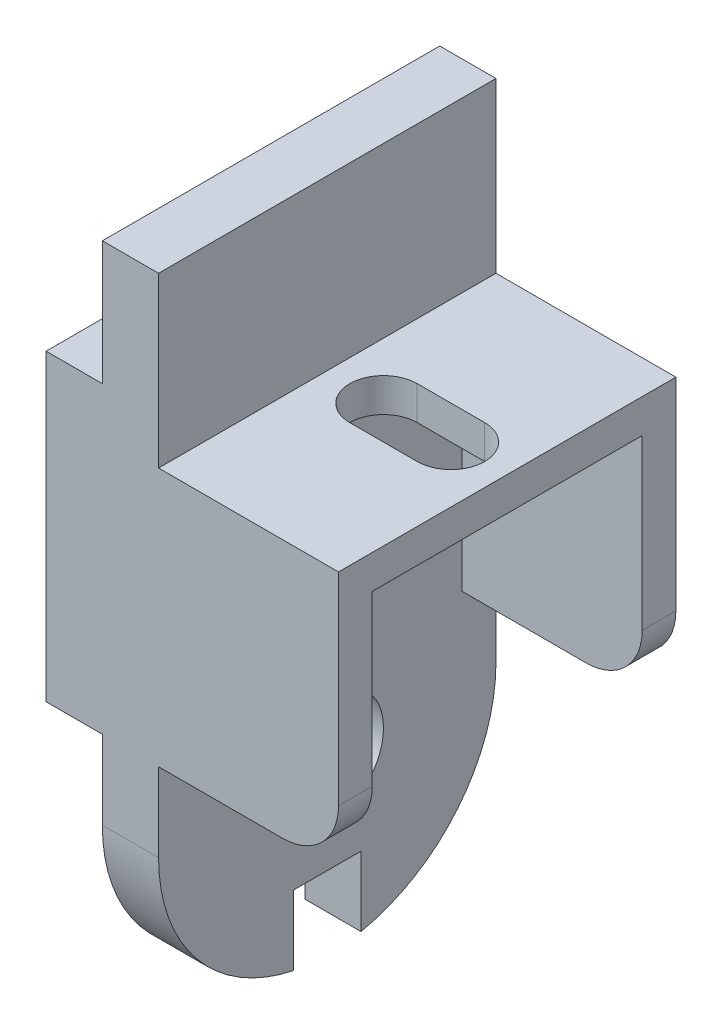
from build123d import *

# Parameters (mm, degrees)
SKETCH_1_R          = 5
EXTRUDE_1_DEPTH     = 5
EXTRUDE_2_DEPTH     = 21
FILLET_1_R          = 5
SKETCH_3_W          = 30
SKETCH_3_H          = 27
EXTRUDE_3_DEPTH     = 5
CUT_EXTRUDE_1_DEPTH = 50.037074512


with BuildPart() as part:
    # Эскиз1 → Бобышка-Вытянуть1 (new body)
    with BuildSketch(Plane(origin=(0, 0, 0), x_dir=(0, 0, -1), z_dir=(1, 0, 0))):
        with BuildLine():
            ThreePointArc((-15, 0), (-11.618950039, -9.486832981), (-3, -14.696938457))
            Line((-3, -14.696938457), (-3, -8.5))
            Line((-3, -8.5), (3, -8.5))
            Line((3, -8.5), (3, -14.696938457))
            ThreePointArc((3, -14.696938457), (11.618950039, -9.486832981), (15, 0))
            Line((15, 0), (15, 45))
            Line((15, 45), (-15, 45))
            Line((-15, 45), (-15, 0))
        make_face()
        Circle(SKETCH_1_R, mode=Mode.SUBTRACT)
    extrude(amount=EXTRUDE_1_DEPTH)

    # Эскиз1<4> → Бобышка-Вытянуть2 (add)
    with BuildSketch(Plane(origin=(0, 0, 0), x_dir=(0, 0, -1), z_dir=(1, 0, 0))):
        Polygon((-15, 30), (-15, 7), (-12, 7), (-12, 27), (12, 27), (12, 7), (15, 7), (15, 30), align=None)
    extrude(amount=EXTRUDE_2_DEPTH)

    # Скругление1
    fillet_1_edges = [part.edges().sort_by_distance(p)[0] for p in [
        (21, 7, 13.5),
        (21, 7, -13.5),
    ]]
    fillet(fillet_1_edges, radius=FILLET_1_R)

    # Эскиз3 → Бобышка-Вытянуть3 (add)
    with BuildSketch(Plane.ZY):
        with Locations((0, 20.5)):
            Rectangle(SKETCH_3_W, SKETCH_3_H)
    extrude(amount=EXTRUDE_3_DEPTH)

    # Эскиз4 → Вырез-Вытянуть1 (cut, through all)
    with BuildSketch(Plane.XZ.offset(-27)):
        with BuildLine():
            Line((10, 3), (16, 3))
            ThreePointArc((16, 3), (19, 0), (16, -3))
            Line((16, -3), (10, -3))
            ThreePointArc((10, -3), (7, 0), (10, 3))
        make_face()
    extrude(amount=-CUT_EXTRUDE_1_DEPTH, mode=Mode.SUBTRACT)


solid = part.part
